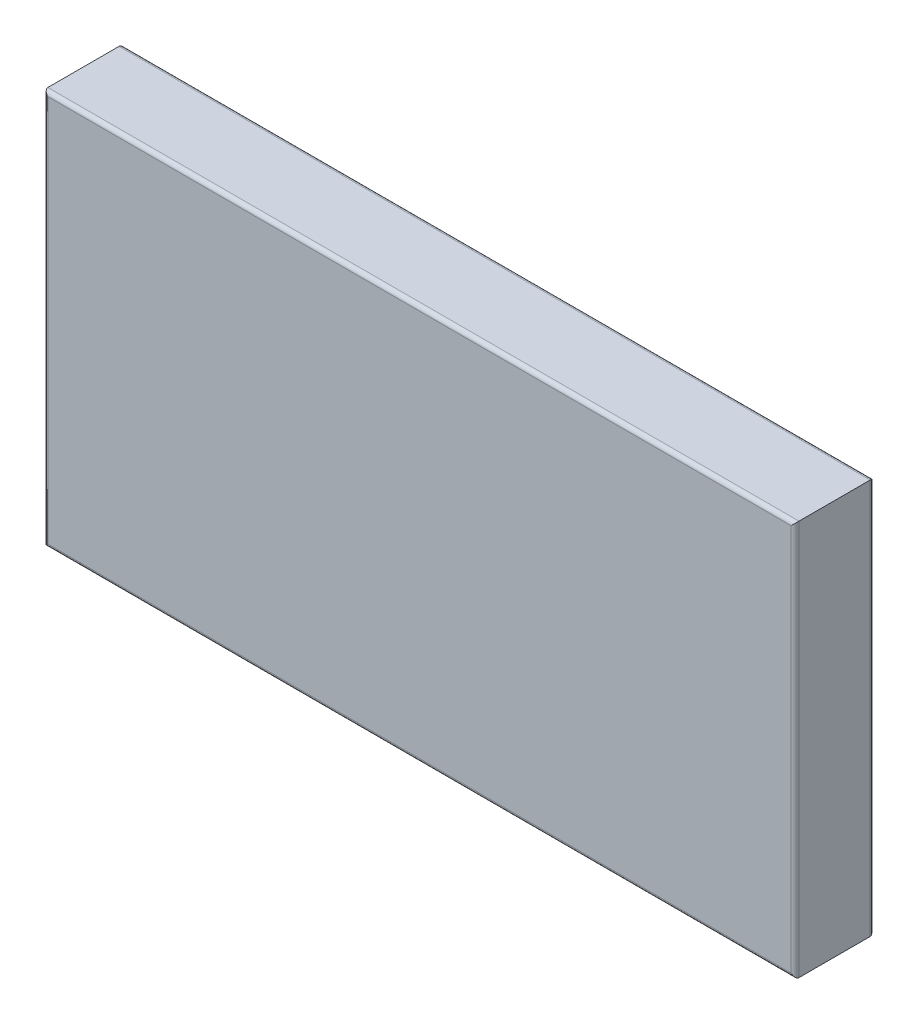
from build123d import *

# Parameters (mm, degrees)
SKETCH1_W           = 190
SKETCH1_H           = 100
BOSS_EXTRUDE1_DEPTH = 20
FILLET1_R           = 1
SCALE1_SCALE        = 10


with BuildPart() as part:
    # Sketch1 → Boss-Extrude1 (new body)
    with BuildSketch(Plane.XY):
        with Locations((95, 50)):
            Rectangle(SKETCH1_W, SKETCH1_H)
    extrude(amount=BOSS_EXTRUDE1_DEPTH)

    # Fillet1
    fillet1_edges = [part.edges().sort_by_distance(p)[0] for p in [
        (190, 50, 20),
        (95, 100, 20),
        (0, 50, 20),
        (95, 100, 0),
        (190, 50, 0),
        (95, 0, 0),
        (0, 50, 0),
        (95, 0, 20),
    ]]
    fillet(fillet1_edges, radius=FILLET1_R)


with BuildPart() as part_1:
    # Scale1: scaled about (0, 0, 0)
    add(part.part.scale(SCALE1_SCALE))


solid = part_1.part
